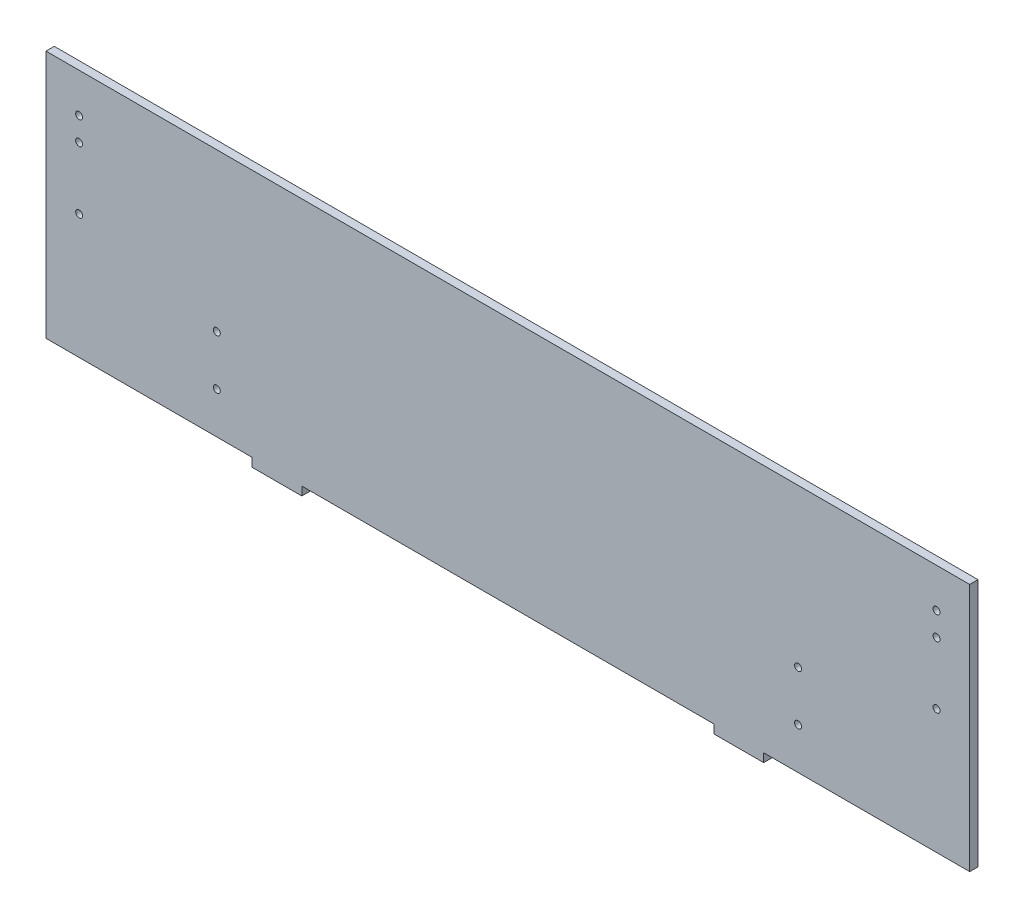
from build123d import *

# Parameters (mm, degrees)
SKETCH1_W           = 557
SKETCH1_H           = 150
BOSS_EXTRUDE1_DEPTH = 5
SKETCH2_W           = 30
SKETCH2_H           = 10.4
BOSS_EXTRUDE2_DEPTH = 5
SKETCH3_R           = 2.1
CUT_EXTRUDE1_DEPTH  = 10
SKETCH4_R           = 2.1
CUT_EXTRUDE2_DEPTH  = 10
SKETCH5_R           = 2.1
CUT_EXTRUDE3_DEPTH  = 10
SKETCH6_R           = 2.1
CUT_EXTRUDE4_DEPTH  = 10


with BuildPart() as part:
    # Sketch1 → Boss-Extrude1 (new body)
    with BuildSketch(Plane.XY):
        with Locations((-17.512478204, -80.075206465)):
            Rectangle(SKETCH1_W, SKETCH1_H)
    extrude(amount=BOSS_EXTRUDE1_DEPTH)

    # Sketch2 → Boss-Extrude2 (add)
    with BuildSketch(Plane.XY.offset(5)):
        with Locations((-156.762478204, -155.075206465)):
            Rectangle(SKETCH2_W, SKETCH2_H)
        with Locations((121.737521796, -155.075206465)):
            Rectangle(SKETCH2_W, SKETCH2_H)
    extrude(amount=-BOSS_EXTRUDE2_DEPTH)

    # Sketch3 → Cut-Extrude1 (cut)
    with BuildSketch(Plane.XY.offset(5)):
        with Locations((-276.012478204, -28.705206465)):
            Circle(SKETCH3_R)
        with Locations((-276.012478204, -42.775206465)):
            Circle(SKETCH3_R)
        with Locations((240.987521796, -42.775206465)):
            Circle(SKETCH3_R)
        with Locations((240.987521796, -28.705206465)):
            Circle(SKETCH3_R)
    extrude(amount=-CUT_EXTRUDE1_DEPTH, mode=Mode.SUBTRACT)

    # Sketch4 → Cut-Extrude2 (cut)
    with BuildSketch(Plane(origin=(0, 0, 0), x_dir=(-1, 0, 0), z_dir=(0, 0, -1))):
        with Locations((-240.987521796, -80.075206465)):
            Circle(SKETCH4_R)
        with Locations((276.012478204, -80.075206465)):
            Circle(SKETCH4_R)
    extrude(amount=-CUT_EXTRUDE2_DEPTH, mode=Mode.SUBTRACT)

    # Sketch5 → Cut-Extrude3 (cut)
    with BuildSketch(Plane(origin=(0, 0, 0), x_dir=(-1, 0, 0), z_dir=(0, 0, -1))):
        with Locations((-157.487521796, -130.075206465)):
            Circle(SKETCH5_R)
        with Locations((-157.487521796, -100.075206465)):
            Circle(SKETCH5_R)
    extrude(amount=-CUT_EXTRUDE3_DEPTH, mode=Mode.SUBTRACT)

    # Sketch6 → Cut-Extrude4 (cut)
    with BuildSketch(Plane(origin=(0, 0, 0), x_dir=(-1, 0, 0), z_dir=(0, 0, -1))):
        with Locations((193.012478204, -130.075206465)):
            Circle(SKETCH6_R)
        with Locations((193.012478204, -100.075206465)):
            Circle(SKETCH6_R)
    extrude(amount=-CUT_EXTRUDE4_DEPTH, mode=Mode.SUBTRACT)


solid = part.part
